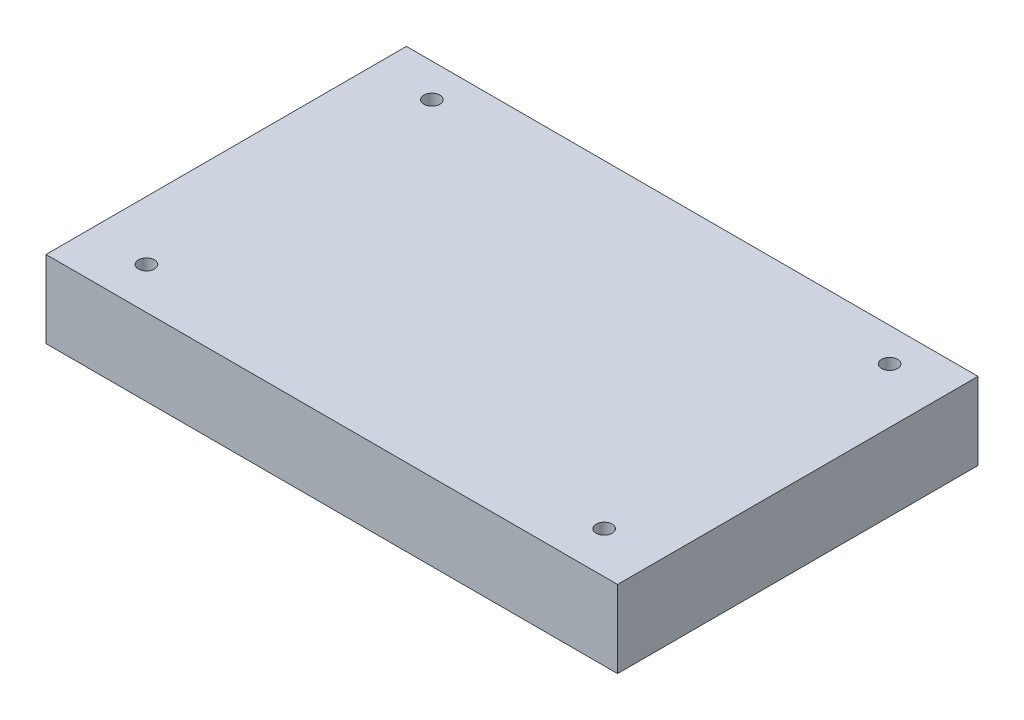
from build123d import *

# Parameters (mm, degrees)
SKETCH1_W           = 111
SKETCH1_H           = 70
BOSS_EXTRUDE1_DEPTH = 15
SKETCH2_R           = 1.555
CUT_EXTRUDE1_DEPTH  = 15


with BuildPart() as part:
    # Sketch1 → Boss-Extrude1 (new body)
    with BuildSketch(Plane(origin=(0, 0, 0), x_dir=(1, 0, 0), z_dir=(0, 1, 0))):
        Rectangle(SKETCH1_W, SKETCH1_H)
    extrude(amount=BOSS_EXTRUDE1_DEPTH)

    # Sketch2 → Cut-Extrude1 (cut)
    with BuildSketch(Plane(origin=(0, 15, 0), x_dir=(1, 0, 0), z_dir=(0, 1, 0))):
        with Locations(Location((-44.065, 28.505, 0), (0, 0, 270))):
            Circle(SKETCH2_R)
        with Locations(Location((-44.065, -26.925, 0), (0, 0, 270))):
            Circle(SKETCH2_R)
        with Locations(Location((44.825, -26.925, 0), (0, 0, 270))):
            Circle(SKETCH2_R)
        with Locations(Location((44.825, 28.505, 0), (0, 0, 270))):
            Circle(SKETCH2_R)
    extrude(amount=-CUT_EXTRUDE1_DEPTH, mode=Mode.SUBTRACT)


solid = part.part
